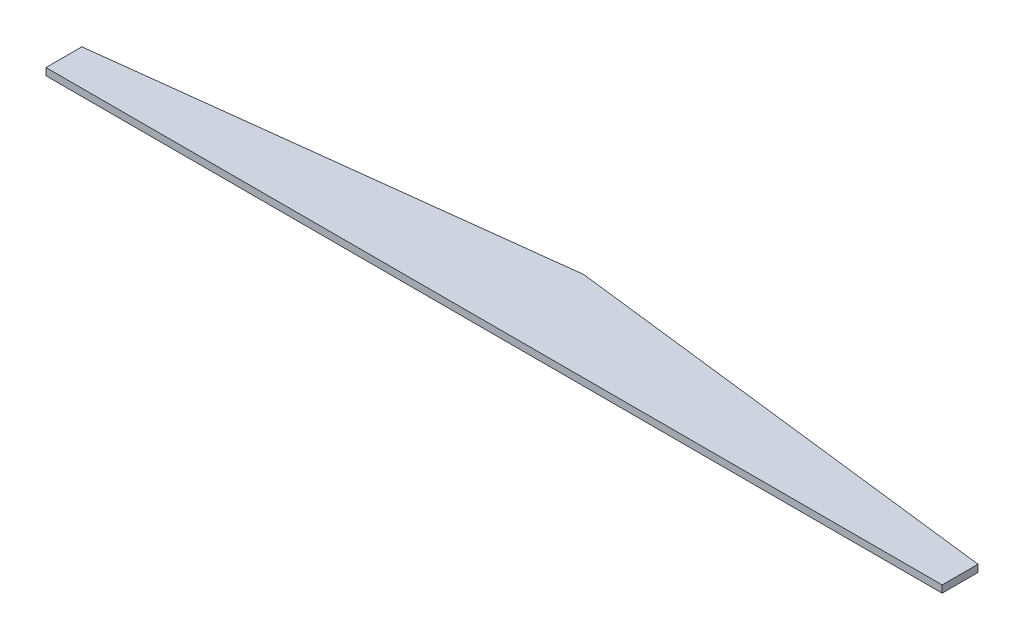
from build123d import *

# Parameters (mm, degrees)
BOSS_EXTRUDE1_DEPTH = 8


with BuildPart() as part:
    # Sketch1 → Boss-Extrude1 (new body)
    with BuildSketch(Plane(origin=(0, 0, 0), x_dir=(1, 0, 0), z_dir=(0, 1, 0))):
        Polygon((0, 0), (500, 0), (500, 40), (0, 100), (-500, 40), (-500, 0), align=None)
    extrude(amount=BOSS_EXTRUDE1_DEPTH)


solid = part.part
